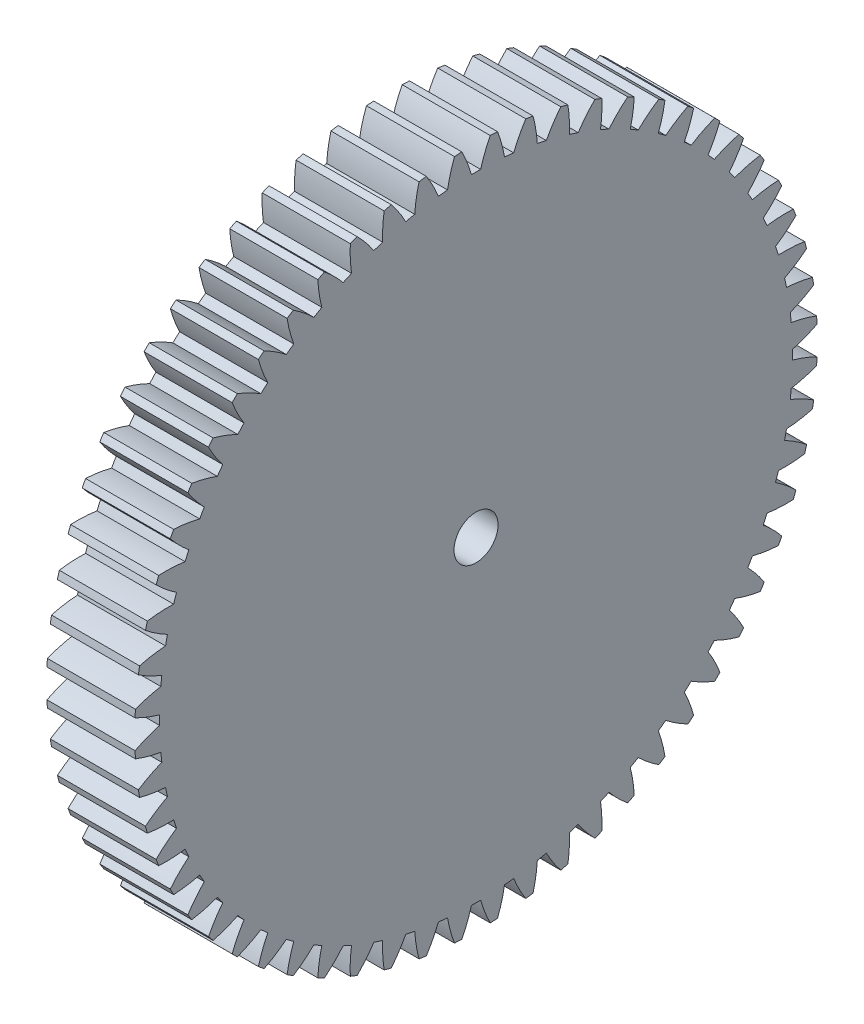
from build123d import *

# Parameters (mm, degrees)
BASPROSKE_W        = 2
BASPROSKE_H        = 7.75
TOOTHCUT_DEPTH     = 12.141139978
TEETHCUTS_COUNT    = 60
TEETHCUTS_ANGLE    = 354
BORSKE_R           = 0.5
BORE_DEPTH         = 50.0000508
SKETCH1_R          = 1.5
CUT_EXTRUDE1_DEPTH = 1


with BuildPart() as part:
    # BasProSke → Base-Revolve (revolve)
    with BuildSketch(Plane(origin=(0, 0, 0), x_dir=(1, 0, 0), z_dir=(0, 1, 0)), mode=Mode.PRIVATE) as base_revolve_sk:
        with Locations((1, 3.875)):
            Rectangle(BASPROSKE_W, BASPROSKE_H)
    revolve(base_revolve_sk.sketch.rotate(Axis((-10, 0, 0), (1, 0, 0)), 180), axis=Axis((-10, 0, 0), (1, 0, 0)))

    # TooCutSke → ToothCut (cut, through all)
    with BuildSketch(Plane(origin=(0, 0, 0), x_dir=(0, 0, -1), z_dir=(1, 0, 0))):
        with BuildLine():
            ThreePointArc((0.104813565, 7.185735618), (0, 7.1865), (-0.104813565, 7.185735618))
            ThreePointArc((-0.104813565, 7.185735618), (-0.204722577, 7.482981855), (-0.335114208, 7.768175051))
            ThreePointArc((-0.335114208, 7.768175051), (0, 7.7754), (0.335114208, 7.768175051))
            ThreePointArc((0.335114208, 7.768175051), (0.204722577, 7.482981855), (0.104813565, 7.185735618))
        make_face()
    toothcut = extrude(amount=TOOTHCUT_DEPTH, mode=Mode.SUBTRACT)

    # TeethCuts: ToothCut ×60 about axis
    teethcuts_axis = Axis((-10, 0, 0), (1, 0, 0))
    for i in range(1, TEETHCUTS_COUNT):
        add(toothcut.rotate(teethcuts_axis, i * TEETHCUTS_ANGLE / (TEETHCUTS_COUNT - 1)), mode=Mode.SUBTRACT)

    # BorSke → Bore (cut, symmetric)
    with BuildSketch(Plane(origin=(0, 0, 0), x_dir=(0, 0, -1), z_dir=(1, 0, 0))):
        with Locations(Location((0, 0, 0), (0, 0, 180))):
            Circle(BORSKE_R)
    extrude(amount=BORE_DEPTH, both=True, mode=Mode.SUBTRACT)

    # Sketch1 → Cut-Extrude1 (cut)
    with BuildSketch(Plane(origin=(0, 0, 0), x_dir=(0, 0, -1), z_dir=(1, 0, 0))):
        Circle(SKETCH1_R)
    extrude(amount=CUT_EXTRUDE1_DEPTH, mode=Mode.SUBTRACT)


solid = part.part
